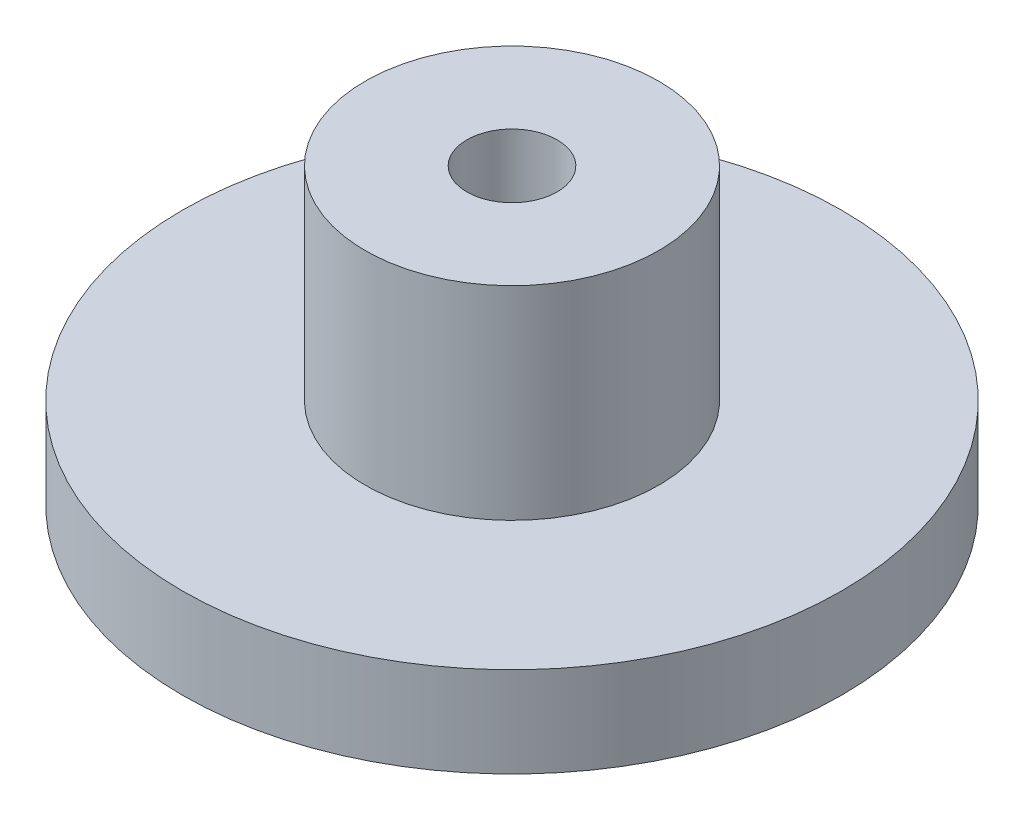
from build123d import *


with BuildPart() as part:
    # Sketch1 → 14 and 35 (revolve)
    with BuildSketch(Plane.XY, mode=Mode.PRIVATE) as f_14_and_35_sk:
        Polygon((1, 6.5), (1, 0), (2.5, 0), (2.5, 0.6), (5.5, 0.6), (5.5, 0), (7.3, 0), (7.3, 2), (3.25, 2), (3.25, 6.5), align=None)
    revolve(f_14_and_35_sk.sketch.rotate(Axis((0, 0, 0), (0, 1, 0)), 90), axis=Axis((0, 0, 0), (0, 1, 0)))


solid = part.part
